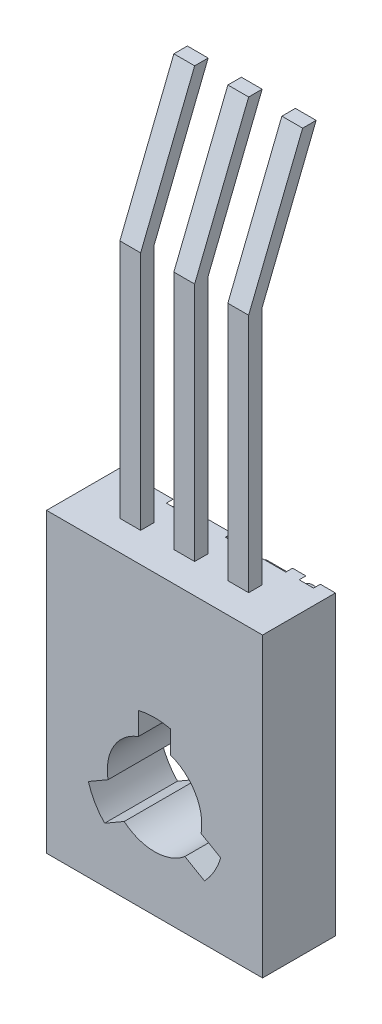
from build123d import *

# Parameters (mm, degrees)
SKETCH1_W           = 8
SKETCH1_H           = 11
SKETCH1_R           = 2.555
BOSS_EXTRUDE1_DEPTH = 1.35
SKETCH2_W           = 0.77
SKETCH2_H           = 0.5
BOSS_EXTRUDE2_DEPTH = 8.9
BOSS_EXTRUDE3_DEPTH = 2.7
CUT_EXTRUDE1_DEPTH  = 0.25
SKETCH6_W           = 0.77
SKETCH6_H           = 0.5


with BuildPart() as part:
    # Sketch1 → Boss-Extrude1 (new, symmetric)
    with BuildSketch(Plane.XY):
        Rectangle(SKETCH1_W, SKETCH1_H)
        with Locations(Location((0, -1.7, 0), (0, 0, 180))):
            Circle(SKETCH1_R, mode=Mode.SUBTRACT)
    extrude(amount=BOSS_EXTRUDE1_DEPTH, both=True)

    # Sketch2 → Boss-Extrude2 (add)
    with BuildSketch(Plane(origin=(0, 5.5, 0), x_dir=(1, 0, 0), z_dir=(0, 1, 0))):
        Rectangle(SKETCH2_W, SKETCH2_H)
        with Locations((-2, 0)):
            Rectangle(SKETCH2_W, SKETCH2_H)
        with Locations((2, 0)):
            Rectangle(SKETCH2_W, SKETCH2_H)
    extrude(amount=BOSS_EXTRUDE2_DEPTH)

    # Sketch4 → Boss-Extrude3 (add)
    with BuildSketch(Plane.XY.offset(1.35)):
        with BuildLine():
            Line((-0.6, 0.823242633), (-0.6, -0.056071778))
            ThreePointArc((-0.6, -0.056071778), (-1.515544457, -0.825), (-1.723683602, -2.002348869))
            Line((-1.723683602, -2.002348869), (-2.48519222, -2.442006074))
            ThreePointArc((-2.48519222, -2.442006074), (-2.246122223, -0.40320073), (-0.6, 0.823242633))
        make_face()
        with BuildLine():
            Line((0.6, 0.823242633), (0.6, -0.056071778))
            ThreePointArc((0.6, -0.056071778), (1.515544457, -0.825), (1.723683602, -2.002348869))
            Line((1.723683602, -2.002348869), (2.48519222, -2.442006074))
            ThreePointArc((2.48519222, -2.442006074), (2.246122223, -0.40320073), (0.6, 0.823242633))
        make_face()
        with BuildLine():
            Line((1.88519222, -3.481236559), (1.123683602, -3.041579353))
            ThreePointArc((1.123683602, -3.041579353), (0, -3.45), (-1.123683602, -3.041579353))
            Line((-1.123683602, -3.041579353), (-1.88519222, -3.481236559))
            ThreePointArc((-1.88519222, -3.481236559), (0, -4.29359854), (1.88519222, -3.481236559))
        make_face()
    extrude(amount=-BOSS_EXTRUDE3_DEPTH)

    # Sketch5 → Cut-Extrude1 (cut)
    # profile 1 of 5: a face of its own
    with BuildSketch(Plane(origin=(0, 0, -1.35), x_dir=(-1, 0, 0), z_dir=(0, 0, -1))):
        Polygon((3.972863248, 3.60042735), (3.972863248, 3.383333333), (2.86025641, 3.383333333), (2.86025641, 3.60042735), (3.321581197, 3.60042735), (3.321581197, 5.5), (3.511538462, 5.5), (3.511538462, 3.60042735), align=None)
    # profile 2 of 5: a face of its own
    with BuildSketch(Plane(origin=(0, 0, -1.35), x_dir=(-1, 0, 0), z_dir=(0, 0, -1))):
        with BuildLine():
            add(Edge.make_bspline(
                [(1.668952991, 3.329059829), (1.629755252, 3.330035831), (1.552767659, 3.331952778), (1.439724532, 3.347110877), (1.331481184, 3.372060207), (1.227972966, 3.407291596), (1.129602445, 3.452973264), (1.036058615, 3.508431834), (0.947663013, 3.574212354), (0.864644267, 3.648753309), (0.789188255, 3.730689393), (0.723529296, 3.818653551), (0.6676474, 3.910875311), (0.621989892, 4.007955253), (0.586113801, 4.109459945), (0.56137149, 4.215994071), (0.545563048, 4.326850183), (0.54371518, 4.402461777), (0.542777778, 4.440818643)],
                knots=[0, 0, 0, 0, 1.065027606, 2.091802087, 3.093458616, 4.079833113, 5.057734272, 6.036020118, 7.030157768, 8.047461502, 9.064242947, 10.052216774, 11.02588392, 11.989864716, 12.962978571, 13.945936472, 14.957997893, 16, 16, 16, 16], degree=3))
            add(Edge.make_bspline(
                [(0.542777778, 4.440818643), (0.543715494, 4.478892744), (0.54556384, 4.553941207), (0.561384335, 4.664096982), (0.586224139, 4.769976505), (0.621546071, 4.871333513), (0.66723721, 4.968217773), (0.723207038, 5.060504058), (0.78871848, 5.148724709), (0.86386512, 5.231059652), (0.945925864, 5.306522625), (1.033346556, 5.373233027), (1.126021706, 5.428806617), (1.22250488, 5.475146665), (1.323756301, 5.510243061), (1.429061868, 5.535818441), (1.539018674, 5.551467565), (1.613921342, 5.553327928), (1.651992521, 5.554273504)],
                knots=[0, 0, 0, 0, 1.043683505, 2.0572211, 3.045299494, 4.022276905, 4.994977706, 5.977452478, 6.97747046, 8.003698437, 9.029677512, 10.031249186, 11.013723958, 11.988083691, 12.9614021, 13.946617861, 14.956316495, 16, 16, 16, 16], degree=3))
            add(Edge.make_bspline(
                [(1.651992521, 5.554273504), (1.690349208, 5.55333662), (1.765960449, 5.551489771), (1.87695558, 5.535654452), (1.983565588, 5.510901323), (2.085462221, 5.475492857), (2.182678919, 5.429903847), (2.275206277, 5.373881723), (2.363155483, 5.307867344), (2.445631552, 5.232779717), (2.521003529, 5.150876329), (2.587297535, 5.063570422), (2.64299668, 4.971692325), (2.688604935, 4.875620778), (2.724679329, 4.775604108), (2.749298332, 4.671013173), (2.765224694, 4.562434054), (2.767060139, 4.48850627), (2.767991453, 4.450994925)],
                knots=[0, 0, 0, 0, 1.053167129, 2.076072758, 3.073341244, 4.055601477, 5.033424535, 6.017524495, 7.021518915, 8.049444456, 9.077120685, 10.074910483, 11.055688766, 12.022980584, 12.991883888, 13.970269434, 14.970104079, 16, 16, 16, 16], degree=3))
            add(Edge.make_bspline(
                [(2.767991453, 4.450994925), (2.767668422, 4.425816958), (2.767026436, 4.375778654), (2.759286145, 4.301475308), (2.748077085, 4.228358898), (2.731928714, 4.156675206), (2.711098686, 4.086412526), (2.68542921, 4.017714549), (2.65601198, 3.950015407), (2.620986705, 3.884603532), (2.582773082, 3.821376258), (2.541104965, 3.761124188), (2.495691825, 3.704923587), (2.447182378, 3.651871401), (2.394905145, 3.602873112), (2.339646896, 3.556860442), (2.281118495, 3.514309699), (2.219227379, 3.476114565), (2.155551483, 3.441031871), (2.089628838, 3.411740708), (2.022850344, 3.385851248), (1.95462779, 3.365276804), (1.885118986, 3.34890354), (1.814237039, 3.33777832), (1.742054955, 3.330020831), (1.693425153, 3.329381541), (1.668952991, 3.329059829)],
                knots=[0, 0, 0, 0, 1.037115869, 2.061148057, 3.07517727, 4.084041727, 5.086514338, 6.092668487, 7.104487461, 8.125783165, 9.147610153, 10.147694368, 11.141876323, 12.122903372, 13.107606018, 14.091946891, 15.084523921, 16.086505767, 17.087268121, 18.077809654, 19.05670789, 20.036870126, 21.011670792, 21.99694167, 22.991993299, 24, 24, 24, 24], degree=3))
        make_face()
        with BuildLine():
            add(Edge.make_bspline(
                [(1.659624733, 3.546153846), (1.679711981, 3.546397737), (1.719694441, 3.546883188), (1.779128706, 3.553317528), (1.837802597, 3.56241344), (1.895587208, 3.575657707), (1.952534217, 3.5926278), (2.008706833, 3.613583435), (2.064155219, 3.63804772), (2.118372327, 3.666445257), (2.170492289, 3.698275947), (2.220828273, 3.731836064), (2.267457888, 3.769027749), (2.311281799, 3.808471798), (2.352193685, 3.850711303), (2.390199011, 3.895435102), (2.425260334, 3.94284567), (2.45695739, 3.99274547), (2.485165207, 4.044856551), (2.510420872, 4.098182599), (2.531356849, 4.153350352), (2.547941263, 4.210015535), (2.562017631, 4.26792844), (2.57084737, 4.327404597), (2.577343358, 4.388238971), (2.577802138, 4.42935204), (2.578034188, 4.450146902)],
                knots=[0, 0, 0, 0, 1.008431664, 2.007222653, 2.999229743, 3.989431819, 4.982149843, 5.98167215, 6.998687425, 8.024288174, 9.053028776, 10.065052016, 11.06063401, 12.045759335, 13.024701188, 14.011819507, 14.991481775, 15.984022113, 16.97831254, 17.965966747, 18.945551853, 19.938269878, 20.93007375, 21.936103907, 22.956087853, 24, 24, 24, 24], degree=3))
            add(Edge.make_bspline(
                [(2.578034188, 4.450146902), (2.577261436, 4.480724311), (2.575741194, 4.540879536), (2.56248726, 4.629044475), (2.541909218, 4.713857207), (2.512074945, 4.794812213), (2.474015442, 4.872270495), (2.427590575, 4.945930613), (2.37237519, 5.015770838), (2.309692252, 5.081271279), (2.241150111, 5.141032327), (2.168403329, 5.193562601), (2.092027452, 5.237773545), (2.012462689, 5.274732901), (1.929029731, 5.302576542), (1.842263518, 5.322429045), (1.752162132, 5.335296017), (1.69076326, 5.336545706), (1.659624733, 5.337179487)],
                knots=[0, 0, 0, 0, 1.032022337, 2.030307203, 3.003823408, 3.974715386, 4.937372378, 5.913284036, 6.909147208, 7.938749767, 8.970518239, 9.975863271, 10.963918693, 11.946286286, 12.933361397, 13.927862637, 14.949112547, 16, 16, 16, 16], degree=3))
            add(Edge.make_bspline(
                [(1.659624733, 5.337179487), (1.638694142, 5.336892153), (1.597182493, 5.336322283), (1.535440227, 5.330574433), (1.474804526, 5.321375585), (1.415387622, 5.308065477), (1.357110942, 5.291628478), (1.300153014, 5.271236903), (1.244522687, 5.246804089), (1.189984351, 5.219530837), (1.137719303, 5.188771724), (1.088321072, 5.154974997), (1.041464804, 5.11904559), (0.997720883, 5.079887192), (0.956979797, 5.038003998), (0.919653712, 4.993090979), (0.884608736, 4.946035575), (0.853133999, 4.896148458), (0.824539225, 4.844449715), (0.800025481, 4.790968428), (0.779077474, 4.73604333), (0.762194272, 4.679620219), (0.748956917, 4.621829718), (0.739837661, 4.562588116), (0.733458231, 4.502015639), (0.732977417, 4.461046725), (0.732735043, 4.440394631)],
                knots=[0, 0, 0, 0, 1.047362266, 2.077233941, 3.100744636, 4.115120168, 5.122788643, 6.129711893, 7.140355774, 8.162227187, 9.180148637, 10.17298275, 11.156396779, 12.133377858, 13.108923632, 14.078087502, 15.054351192, 16.043448276, 17.028082865, 18.009331763, 18.985518559, 19.968016174, 20.954783108, 21.950335389, 22.966780876, 24, 24, 24, 24], degree=3))
            add(Edge.make_bspline(
                [(0.732735043, 4.440394631), (0.732977621, 4.419883826), (0.733458818, 4.379196867), (0.739834505, 4.319046753), (0.748966949, 4.260231715), (0.762128206, 4.202982654), (0.779091869, 4.147284973), (0.800008971, 4.093190991), (0.824674358, 4.040499165), (0.852982222, 3.989339805), (0.884802146, 3.940248238), (0.919572924, 3.893317914), (0.957892195, 3.849426224), (0.998675159, 3.807504447), (1.042902317, 3.768391073), (1.090581423, 3.732237359), (1.140525191, 3.697413836), (1.193863598, 3.666596107), (1.248711693, 3.637987907), (1.305049655, 3.613601029), (1.362172981, 3.592534717), (1.420157967, 3.575730793), (1.478904447, 3.562400574), (1.538428744, 3.553320824), (1.598708757, 3.546882496), (1.639254972, 3.5463975), (1.659624733, 3.546153846)],
                knots=[0, 0, 0, 0, 1.02988216, 2.042960975, 3.035124439, 4.018561492, 4.99104521, 5.957523397, 6.929462691, 7.91146347, 8.892205782, 9.866320947, 10.842813644, 11.816825305, 12.802668543, 13.805243666, 14.821427616, 15.858893029, 16.897256944, 17.927432741, 18.940436917, 19.95373962, 20.957947499, 21.96413624, 22.977215056, 24, 24, 24, 24], degree=3))
        make_face(mode=Mode.SUBTRACT)
    # profile 3 of 5: a face of its own
    with BuildSketch(Plane(origin=(0, 0, -1.35), x_dir=(-1, 0, 0), z_dir=(0, 0, -1))):
        Polygon((0.027773104, 3.383333333), (-0.363589744, 3.383333333), (-0.363589744, 5.5), (-0.173632479, 5.5), (-0.173632479, 3.60042735), (0.152008547, 3.60042735), align=None)
    # profile 4 of 5: a face of its own
    with BuildSketch(Plane(origin=(0, 0, -1.35), x_dir=(-1, 0, 0), z_dir=(0, 0, -1))):
        with BuildLine():
            Line((-1.242820513, 4.034615385), (-1.052863248, 4.034615385))
            add(Edge.make_bspline(
                [(-1.052863248, 4.034615385), (-1.054101077, 4.009414295), (-1.056532141, 3.959920025), (-1.067921755, 3.88775923), (-1.08420378, 3.818776871), (-1.107279207, 3.753564345), (-1.135775342, 3.691342634), (-1.170662859, 3.632937969), (-1.211198011, 3.577770693), (-1.257306436, 3.526885303), (-1.307338326, 3.480369695), (-1.360993912, 3.439776011), (-1.417721718, 3.405870729), (-1.47702971, 3.377372558), (-1.539603802, 3.356007194), (-1.604845856, 3.340147481), (-1.67305076, 3.330607056), (-1.719520626, 3.32958144), (-1.74315438, 3.329059829)],
                knots=[0, 0, 0, 0, 1.100776268, 2.161895295, 3.184016182, 4.190939212, 5.176500551, 6.166955529, 7.155448256, 8.160289653, 9.16017456, 10.133824356, 11.091467644, 12.04088621, 13.000931625, 13.972173743, 14.968683325, 16, 16, 16, 16], degree=3))
            add(Edge.make_bspline(
                [(-1.74315438, 3.329059829), (-1.766365611, 3.329598772), (-1.81197485, 3.330657775), (-1.878513057, 3.339888965), (-1.942006465, 3.354034941), (-2.001735502, 3.374997049), (-2.058313158, 3.401299909), (-2.111038906, 3.434010961), (-2.161187711, 3.471582429), (-2.206298355, 3.515899817), (-2.247737925, 3.563186583), (-2.283456328, 3.613688451), (-2.314217298, 3.665908938), (-2.339394191, 3.720255961), (-2.358479395, 3.776906501), (-2.372619703, 3.835317429), (-2.380703067, 3.896162848), (-2.381936843, 3.937352283), (-2.382564103, 3.958293269)],
                knots=[0, 0, 0, 0, 1.111674182, 2.184400057, 3.212814286, 4.223731311, 5.211378316, 6.196328225, 7.191884489, 8.207283132, 9.220262353, 10.201199469, 11.166417575, 12.120932471, 13.06540007, 14.026332106, 14.996573967, 16, 16, 16, 16], degree=3))
            add(Edge.make_bspline(
                [(-2.382564103, 3.958293269), (-2.381540066, 3.98777409), (-2.379509962, 4.046218384), (-2.362144837, 4.132103749), (-2.335022478, 4.215314299), (-2.302369827, 4.282286284), (-2.269420491, 4.336246193), (-2.239758052, 4.380696051), (-2.204835779, 4.428544003), (-2.164952032, 4.479983714), (-2.119419955, 4.534341536), (-2.069422467, 4.592726515), (-2.013668364, 4.654059074), (-1.974571334, 4.695977328), (-1.954312233, 4.717698317)],
                knots=[0, 0, 0, 0, 1.184416499, 2.348048165, 3.509039915, 4.696071444, 5.333504901, 6.05069495, 6.844171097, 7.714965912, 8.667477798, 9.695072654, 10.805644396, 12, 12, 12, 12], degree=3))
            Line((-1.954312233, 4.717698317), (-1.424721554, 5.282905983))
            Line((-1.424721554, 5.282905983), (-2.409700855, 5.282905983))
            Line((-2.409700855, 5.282905983), (-2.409700855, 5.5))
            Line((-2.409700855, 5.5), (-0.971452991, 5.5))
            Line((-0.971452991, 5.5), (-1.792339744, 4.62399172))
            add(Edge.make_bspline(
                [(-1.792339744, 4.62399172), (-1.812327262, 4.603129596), (-1.850719193, 4.563057726), (-1.904997659, 4.504536299), (-1.953826866, 4.45030891), (-1.997239207, 4.400135265), (-2.035270399, 4.354299803), (-2.067798761, 4.312443322), (-2.094968062, 4.274925021), (-2.123761859, 4.23085009), (-2.151218655, 4.176973346), (-2.17535037, 4.11146433), (-2.189959381, 4.043878805), (-2.191720819, 3.998220339), (-2.192606838, 3.975253739)],
                knots=[0, 0, 0, 0, 1.329530082, 2.553755191, 3.672934919, 4.687409497, 5.60679272, 6.413407421, 7.126401618, 7.737995624, 8.834647426, 9.90044882, 10.943907757, 12, 12, 12, 12], degree=3))
            add(Edge.make_bspline(
                [(-2.192606838, 3.975253739), (-2.192226314, 3.960809583), (-2.191476376, 3.932342926), (-2.184732436, 3.890633771), (-2.174824251, 3.850244426), (-2.159552676, 3.811674277), (-2.141204441, 3.774164723), (-2.117763218, 3.738856172), (-2.090976056, 3.704545039), (-2.059904262, 3.672407826), (-2.025793205, 3.642965149), (-1.989751703, 3.616885903), (-1.951621707, 3.595090676), (-1.911562123, 3.577223934), (-1.869685123, 3.563208335), (-1.825909581, 3.553496721), (-1.780356487, 3.547399218), (-1.749251468, 3.546574219), (-1.73340211, 3.546153846)],
                knots=[0, 0, 0, 0, 0.991504627, 1.954065223, 2.895985987, 3.842598665, 4.797835564, 5.759220273, 6.74786863, 7.784730864, 8.824135544, 9.839918996, 10.835834653, 11.835434876, 12.84861661, 13.863796685, 14.911511676, 16, 16, 16, 16], degree=3))
            add(Edge.make_bspline(
                [(-1.73340211, 3.546153846), (-1.716845045, 3.546569076), (-1.684329703, 3.54738452), (-1.636692568, 3.55356491), (-1.590930223, 3.562924794), (-1.54774785, 3.577825654), (-1.506241722, 3.595265163), (-1.467470678, 3.61784626), (-1.430345593, 3.643648655), (-1.395612877, 3.673732609), (-1.363978879, 3.707692862), (-1.335201147, 3.744657997), (-1.31081749, 3.785283331), (-1.289172363, 3.828594048), (-1.272618114, 3.875780072), (-1.258465418, 3.92568741), (-1.248185105, 3.979028124), (-1.24463841, 4.015778548), (-1.242820513, 4.034615385)],
                knots=[0, 0, 0, 0, 1.031072318, 2.024855787, 2.988461151, 3.935103592, 4.865765533, 5.788564469, 6.724086513, 7.67908574, 8.64457978, 9.611397706, 10.591395687, 11.591555111, 12.622101007, 13.700900657, 14.821571223, 16, 16, 16, 16], degree=3))
        make_face()
    # profile 5 of 5: a face of its own
    with BuildSketch(Plane(origin=(0, 0, -1.35), x_dir=(-1, 0, 0), z_dir=(0, 0, -1))):
        with BuildLine():
            Line((-3.397478632, 3.329059829), (-3.543762687, 3.443967014))
            Line((-3.543762687, 3.443967014), (-2.984491186, 4.299198718))
            add(Edge.make_bspline(
                [(-2.984491186, 4.299198718), (-3.021726544, 4.293263669), (-3.09435832, 4.281686685), (-3.167876744, 4.27977688), (-3.203705262, 4.278846154)],
                knots=[0, 0, 0, 0, 1.025318673, 2, 2, 2, 2], degree=3))
            add(Edge.make_bspline(
                [(-3.203705262, 4.278846154), (-3.225218152, 4.279424374), (-3.267565638, 4.280562582), (-3.329739274, 4.289321864), (-3.389483062, 4.303125621), (-3.446549362, 4.323247418), (-3.501143054, 4.348951208), (-3.55357724, 4.37975715), (-3.602867009, 4.41725562), (-3.649644292, 4.459145209), (-3.69212153, 4.505537806), (-3.729699496, 4.554776767), (-3.761437227, 4.606858199), (-3.786722854, 4.661770389), (-3.806930547, 4.719083492), (-3.821315965, 4.779021033), (-3.829915785, 4.841684174), (-3.831076871, 4.884307959), (-3.831666667, 4.905959535)],
                knots=[0, 0, 0, 0, 1.043709831, 2.054511743, 3.041122595, 4.01515914, 4.98481438, 5.965901842, 6.960491961, 7.985277438, 9.0096037, 10.00832444, 10.987059228, 11.962929573, 12.936966118, 13.931840027, 14.949438142, 16, 16, 16, 16], degree=3))
            add(Edge.make_bspline(
                [(-3.831666667, 4.905959535), (-3.830564127, 4.935564083), (-3.82839587, 4.993784478), (-3.812552535, 5.078917729), (-3.785412066, 5.159323486), (-3.74851777, 5.235211696), (-3.701561796, 5.304993099), (-3.64524165, 5.367847061), (-3.579835392, 5.42263308), (-3.506645298, 5.46961113), (-3.427441589, 5.506940502), (-3.344391084, 5.534537493), (-3.258207089, 5.551027708), (-3.199676176, 5.553186596), (-3.170208333, 5.554273504)],
                knots=[0, 0, 0, 0, 1.0319111, 2.029359566, 3.00642934, 3.98275322, 4.962714161, 5.929339302, 6.915525103, 7.928435063, 8.953439721, 9.960121214, 10.9730072, 12, 12, 12, 12], degree=3))
            add(Edge.make_bspline(
                [(-3.170208333, 5.554273504), (-3.141724839, 5.553351932), (-3.085304023, 5.55152646), (-3.002328471, 5.535180041), (-2.922457509, 5.508873915), (-2.84671823, 5.471871925), (-2.776435443, 5.425925627), (-2.713074062, 5.37098903), (-2.65823736, 5.307026502), (-2.612434968, 5.235231601), (-2.574953238, 5.158691702), (-2.5487642, 5.078014061), (-2.531736833, 4.994870697), (-2.529984581, 4.938267529), (-2.529102564, 4.909775641)],
                knots=[0, 0, 0, 0, 1.01206923, 2.004731945, 2.994948482, 3.995280086, 4.993424783, 5.973125358, 6.967517142, 7.97830003, 8.994392566, 9.989381197, 10.98793077, 12, 12, 12, 12], degree=3))
            add(Edge.make_bspline(
                [(-2.529102564, 4.909775641), (-2.529869673, 4.887985187), (-2.531435267, 4.843513042), (-2.540778548, 4.775963896), (-2.557915268, 4.707117459), (-2.576460943, 4.648754517), (-2.594863852, 4.600419426), (-2.611927453, 4.562250482), (-2.631006637, 4.521942851), (-2.653370098, 4.480259194), (-2.677077172, 4.436008518), (-2.704769724, 4.390829561), (-2.733667328, 4.343072248), (-2.754836976, 4.311276171), (-2.765701122, 4.2949586)],
                knots=[0, 0, 0, 0, 1.17367173, 2.395347028, 3.66355231, 4.98980831, 5.690886799, 6.447442954, 7.240630024, 8.091733897, 8.994365608, 9.943299771, 10.944512865, 12, 12, 12, 12], degree=3))
            Line((-2.765701122, 4.2949586), (-3.397478632, 3.329059829))
        make_face()
        with BuildLine():
            add(Edge.make_bspline(
                [(-3.163848157, 4.495940171), (-3.147722758, 4.496412355), (-3.116084857, 4.497338775), (-3.069753126, 4.502686575), (-3.025876911, 4.512474541), (-2.984528211, 4.526252073), (-2.945096799, 4.543084659), (-2.908209011, 4.564430456), (-2.873616591, 4.58953265), (-2.842118391, 4.618424934), (-2.813187678, 4.649574996), (-2.788304451, 4.683144881), (-2.766816273, 4.718102483), (-2.749351121, 4.754778061), (-2.735749585, 4.793147646), (-2.725911274, 4.833037407), (-2.720435881, 4.874714121), (-2.719524974, 4.902976163), (-2.719059829, 4.917407853)],
                knots=[0, 0, 0, 0, 1.129540697, 2.216149546, 3.260829642, 4.271906843, 5.264942922, 6.258225651, 7.250175744, 8.252297429, 9.247108021, 10.223125336, 11.173816288, 12.116901384, 13.062424938, 14.020354563, 14.989116641, 16, 16, 16, 16], degree=3))
            add(Edge.make_bspline(
                [(-2.719059829, 4.917407853), (-2.719453018, 4.931707418), (-2.720227844, 4.959886465), (-2.726794355, 5.001259793), (-2.737364396, 5.040946988), (-2.75239049, 5.079031769), (-2.771586721, 5.11545623), (-2.794546424, 5.150660697), (-2.822387043, 5.183708071), (-2.85401457, 5.21480231), (-2.888381529, 5.24325608), (-2.924651443, 5.268695435), (-2.962954452, 5.289810603), (-3.00288264, 5.307459885), (-3.044937628, 5.320426274), (-3.088407238, 5.330360005), (-3.133890491, 5.335789342), (-3.164683163, 5.336710024), (-3.180384615, 5.337179487)],
                knots=[0, 0, 0, 0, 0.98953633, 1.950002717, 2.892353065, 3.828177645, 4.777967117, 5.738732544, 6.732276577, 7.76327951, 8.805689376, 9.818183401, 10.825652611, 11.829169732, 12.834974292, 13.867693979, 14.912718532, 16, 16, 16, 16], degree=3))
            add(Edge.make_bspline(
                [(-3.180384615, 5.337179487), (-3.196086094, 5.33671006), (-3.226878816, 5.33578945), (-3.272361703, 5.330359593), (-3.315832665, 5.320427781), (-3.357882741, 5.307454422), (-3.397829145, 5.289830991), (-3.436165665, 5.268562336), (-3.472781888, 5.243410298), (-3.507126496, 5.214753106), (-3.538886011, 5.183884461), (-3.566086894, 5.150358613), (-3.589787041, 5.115733285), (-3.608251182, 5.07888689), (-3.623445515, 5.040969636), (-3.633963773, 5.001253612), (-3.640544283, 4.959888078), (-3.641317188, 4.931707961), (-3.641709402, 4.917407853)],
                knots=[0, 0, 0, 0, 1.087095469, 2.131941252, 3.164484274, 4.170116773, 5.173462224, 6.180759088, 7.201132453, 8.243363996, 9.274190558, 10.261329848, 11.227346438, 12.172477233, 13.108141724, 14.050330866, 15.010632948, 16, 16, 16, 16], degree=3))
            add(Edge.make_bspline(
                [(-3.641709402, 4.917407853), (-3.641380484, 4.902955661), (-3.640734927, 4.874590709), (-3.633291915, 4.833074956), (-3.623238891, 4.792823276), (-3.606992272, 4.754742435), (-3.587641261, 4.717779227), (-3.562989198, 4.68299053), (-3.534725561, 4.64938904), (-3.501991346, 4.618218458), (-3.466387672, 4.589687184), (-3.428495545, 4.564577282), (-3.38901308, 4.543142688), (-3.347382207, 4.526229266), (-3.304163565, 4.512603574), (-3.25905859, 4.502752135), (-3.212035237, 4.497330449), (-3.180115105, 4.496409499), (-3.163848157, 4.495940171)],
                knots=[0, 0, 0, 0, 0.978317929, 1.920119929, 2.851929572, 3.784133089, 4.71845084, 5.67514162, 6.667477147, 7.690549442, 8.733345855, 9.756283585, 10.767808623, 11.772962645, 12.797066014, 13.836159554, 14.89727653, 16, 16, 16, 16], degree=3))
        make_face(mode=Mode.SUBTRACT)
    extrude(amount=-CUT_EXTRUDE1_DEPTH, mode=Mode.SUBTRACT)

    # Sweep1: sweep along a path in Sketch7
    with BuildLine(Plane(origin=(0, 0, 0), x_dir=(0, 0, -1), z_dir=(1, 0, 0))) as sweep1_path:
        Line((0, 14.4), (2, 19.4))
    # Sketch6 → Sweep1 (sweep)
    with BuildSketch(Plane(origin=(0, 14.4, 0), x_dir=(1, 0, 0), z_dir=(0, 1, 0))):
        with Locations((2, 0)):
            Rectangle(SKETCH6_W, SKETCH6_H)
        Rectangle(SKETCH6_W, SKETCH6_H)
        with Locations((-2, 0)):
            Rectangle(SKETCH6_W, SKETCH6_H)
    sweep(path=sweep1_path.line)


solid = part.part
